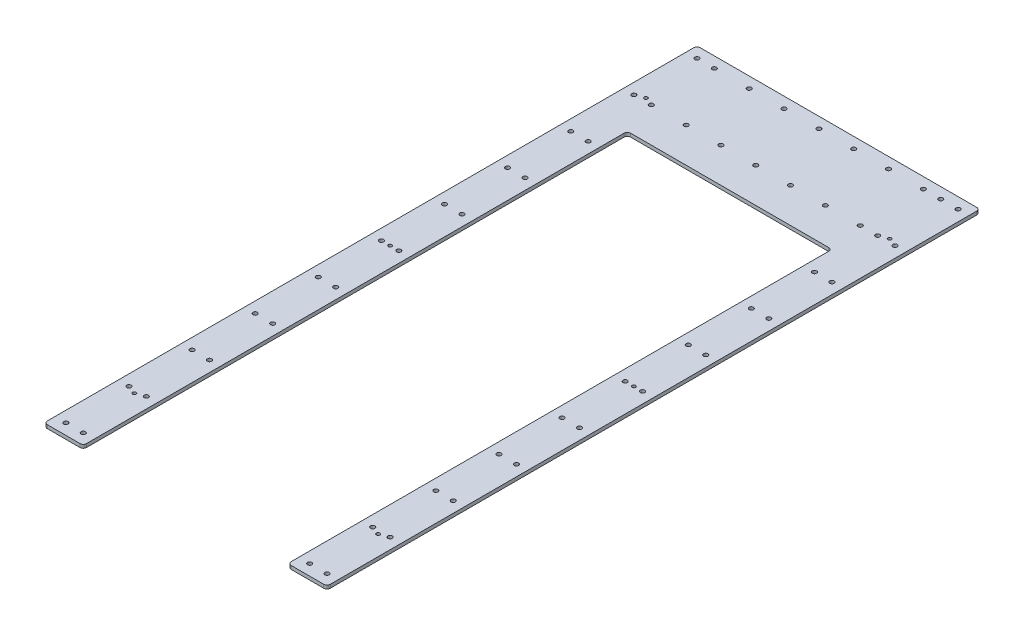
from build123d import *

# Parameters (mm, degrees)
SKETCH1_R           = 2
SKETCH1_R_2         = 1.6
BOSS_EXTRUDE1_DEPTH = 3.175
FILLET1_R           = 3


with BuildPart() as part:
    # Sketch1 → Boss-Extrude1 (new body)
    with BuildSketch(Plane(origin=(0, 0, 0), x_dir=(1, 0, 0), z_dir=(0, 1, 0))):
        Polygon((-130, -300), (-94, -300), (-94, 200), (94, 200), (94, -300), (130, -300), (130, 300), (-130, 300), align=None)
        with Locations(Location((120, 290, 0), (0, 0, 270))):
            Circle(SKETCH1_R, mode=Mode.SUBTRACT)
        with Locations(Location((120, 232, 0), (0, 0, 270))):
            Circle(SKETCH1_R, mode=Mode.SUBTRACT)
        with Locations(Location((120, 174, 0), (0, 0, 270))):
            Circle(SKETCH1_R, mode=Mode.SUBTRACT)
        with Locations(Location((120, 116, 0), (0, 0, 270))):
            Circle(SKETCH1_R, mode=Mode.SUBTRACT)
        with Locations(Location((120, 58, 0), (0, 0, 270))):
            Circle(SKETCH1_R, mode=Mode.SUBTRACT)
        with Locations(Location((120, 0, 0), (0, 0, 270))):
            Circle(SKETCH1_R, mode=Mode.SUBTRACT)
        with Locations(Location((120, -58, 0), (0, 0, 270))):
            Circle(SKETCH1_R, mode=Mode.SUBTRACT)
        with Locations(Location((120, -116, 0), (0, 0, 270))):
            Circle(SKETCH1_R, mode=Mode.SUBTRACT)
        with Locations(Location((120, -174, 0), (0, 0, 270))):
            Circle(SKETCH1_R, mode=Mode.SUBTRACT)
        with Locations(Location((120, -232, 0), (0, 0, 270))):
            Circle(SKETCH1_R, mode=Mode.SUBTRACT)
        with Locations(Location((120, -290, 0), (0, 0, 270))):
            Circle(SKETCH1_R, mode=Mode.SUBTRACT)
        with Locations(Location((-120, 232, 0), (0, 0, 90))):
            Circle(SKETCH1_R, mode=Mode.SUBTRACT)
        with Locations(Location((-120, -290, 0), (0, 0, 90))):
            Circle(SKETCH1_R, mode=Mode.SUBTRACT)
        with Locations(Location((-120, -232, 0), (0, 0, 90))):
            Circle(SKETCH1_R, mode=Mode.SUBTRACT)
        with Locations(Location((-120, -174, 0), (0, 0, 90))):
            Circle(SKETCH1_R, mode=Mode.SUBTRACT)
        with Locations(Location((-120, -116, 0), (0, 0, 90))):
            Circle(SKETCH1_R, mode=Mode.SUBTRACT)
        with Locations(Location((-120, -58, 0), (0, 0, 90))):
            Circle(SKETCH1_R, mode=Mode.SUBTRACT)
        with Locations(Location((-120, 0, 0), (0, 0, 90))):
            Circle(SKETCH1_R, mode=Mode.SUBTRACT)
        with Locations(Location((-120, 58, 0), (0, 0, 90))):
            Circle(SKETCH1_R, mode=Mode.SUBTRACT)
        with Locations(Location((-120, 116, 0), (0, 0, 90))):
            Circle(SKETCH1_R, mode=Mode.SUBTRACT)
        with Locations(Location((-120, 174, 0), (0, 0, 90))):
            Circle(SKETCH1_R, mode=Mode.SUBTRACT)
        with Locations(Location((-120, 290, 0), (0, 0, 90))):
            Circle(SKETCH1_R, mode=Mode.SUBTRACT)
        with Locations(Location((112, 235, 0), (0, 0, 270))):
            Circle(SKETCH1_R_2, mode=Mode.SUBTRACT)
        with Locations(Location((-112, 235, 0), (0, 0, 90))):
            Circle(SKETCH1_R_2, mode=Mode.SUBTRACT)
        with Locations(Location((112, -235, 0), (0, 0, 90))):
            Circle(SKETCH1_R_2, mode=Mode.SUBTRACT)
        with Locations(Location((-112, -235, 0), (0, 0, 270))):
            Circle(SKETCH1_R_2, mode=Mode.SUBTRACT)
        with Locations(Location((104, 290, 0), (0, 0, 270))):
            Circle(SKETCH1_R, mode=Mode.SUBTRACT)
        with Locations(Location((104, 232, 0), (0, 0, 270))):
            Circle(SKETCH1_R, mode=Mode.SUBTRACT)
        with Locations(Location((104, 174, 0), (0, 0, 270))):
            Circle(SKETCH1_R, mode=Mode.SUBTRACT)
        with Locations(Location((104, 116, 0), (0, 0, 270))):
            Circle(SKETCH1_R, mode=Mode.SUBTRACT)
        with Locations(Location((104, 58, 0), (0, 0, 270))):
            Circle(SKETCH1_R, mode=Mode.SUBTRACT)
        with Locations(Location((104, 0, 0), (0, 0, 270))):
            Circle(SKETCH1_R, mode=Mode.SUBTRACT)
        with Locations(Location((104, -58, 0), (0, 0, 270))):
            Circle(SKETCH1_R, mode=Mode.SUBTRACT)
        with Locations(Location((104, -116, 0), (0, 0, 270))):
            Circle(SKETCH1_R, mode=Mode.SUBTRACT)
        with Locations(Location((104, -174, 0), (0, 0, 270))):
            Circle(SKETCH1_R, mode=Mode.SUBTRACT)
        with Locations(Location((104, -232, 0), (0, 0, 270))):
            Circle(SKETCH1_R, mode=Mode.SUBTRACT)
        with Locations(Location((104, -290, 0), (0, 0, 270))):
            Circle(SKETCH1_R, mode=Mode.SUBTRACT)
        with Locations(Location((-104, -290, 0), (0, 0, 90))):
            Circle(SKETCH1_R, mode=Mode.SUBTRACT)
        with Locations(Location((-104, -232, 0), (0, 0, 90))):
            Circle(SKETCH1_R, mode=Mode.SUBTRACT)
        with Locations(Location((-104, -174, 0), (0, 0, 90))):
            Circle(SKETCH1_R, mode=Mode.SUBTRACT)
        with Locations(Location((-104, -116, 0), (0, 0, 90))):
            Circle(SKETCH1_R, mode=Mode.SUBTRACT)
        with Locations(Location((-104, -58, 0), (0, 0, 90))):
            Circle(SKETCH1_R, mode=Mode.SUBTRACT)
        with Locations(Location((-104, 0, 0), (0, 0, 90))):
            Circle(SKETCH1_R, mode=Mode.SUBTRACT)
        with Locations(Location((-104, 58, 0), (0, 0, 90))):
            Circle(SKETCH1_R, mode=Mode.SUBTRACT)
        with Locations(Location((-104, 116, 0), (0, 0, 90))):
            Circle(SKETCH1_R, mode=Mode.SUBTRACT)
        with Locations(Location((-104, 174, 0), (0, 0, 90))):
            Circle(SKETCH1_R, mode=Mode.SUBTRACT)
        with Locations(Location((-104, 232, 0), (0, 0, 90))):
            Circle(SKETCH1_R, mode=Mode.SUBTRACT)
        with Locations(Location((-104, 290, 0), (0, 0, 90))):
            Circle(SKETCH1_R, mode=Mode.SUBTRACT)
        with Locations(Location((112, 0, 0), (0, 0, 270))):
            Circle(SKETCH1_R_2, mode=Mode.SUBTRACT)
        with Locations(Location((-112, 0, 0), (0, 0, 90))):
            Circle(SKETCH1_R_2, mode=Mode.SUBTRACT)
        with Locations(Location((-72, 290, 0), (0, 0, 90))):
            Circle(SKETCH1_R, mode=Mode.SUBTRACT)
        with Locations(Location((-40, 290, 0), (0, 0, 90))):
            Circle(SKETCH1_R, mode=Mode.SUBTRACT)
        with Locations(Location((-8, 290, 0), (0, 0, 90))):
            Circle(SKETCH1_R, mode=Mode.SUBTRACT)
        with Locations(Location((24, 290, 0), (0, 0, 90))):
            Circle(SKETCH1_R, mode=Mode.SUBTRACT)
        with Locations(Location((56, 290, 0), (0, 0, 90))):
            Circle(SKETCH1_R, mode=Mode.SUBTRACT)
        with Locations(Location((88, 290, 0), (0, 0, 90))):
            Circle(SKETCH1_R, mode=Mode.SUBTRACT)
        with Locations(Location((-72, 232, 0), (0, 0, 90))):
            Circle(SKETCH1_R, mode=Mode.SUBTRACT)
        with Locations(Location((-40, 232, 0), (0, 0, 90))):
            Circle(SKETCH1_R, mode=Mode.SUBTRACT)
        with Locations(Location((-8, 232, 0), (0, 0, 90))):
            Circle(SKETCH1_R, mode=Mode.SUBTRACT)
        with Locations(Location((24, 232, 0), (0, 0, 90))):
            Circle(SKETCH1_R, mode=Mode.SUBTRACT)
        with Locations(Location((56, 232, 0), (0, 0, 90))):
            Circle(SKETCH1_R, mode=Mode.SUBTRACT)
        with Locations(Location((88, 232, 0), (0, 0, 90))):
            Circle(SKETCH1_R, mode=Mode.SUBTRACT)
    extrude(amount=BOSS_EXTRUDE1_DEPTH)

    # Fillet1
    fillet1_edges = [part.edges().sort_by_distance(p)[0] for p in [
        (130, 1.5875, 300),
        (94, 1.5875, 300),
        (94, 1.5875, -200),
        (-94, 1.5875, -200),
        (-94, 1.5875, 300),
        (-130, 1.5875, 300),
        (-130, 1.5875, -300),
        (130, 1.5875, -300),
    ]]
    fillet(fillet1_edges, radius=FILLET1_R)


solid = part.part
